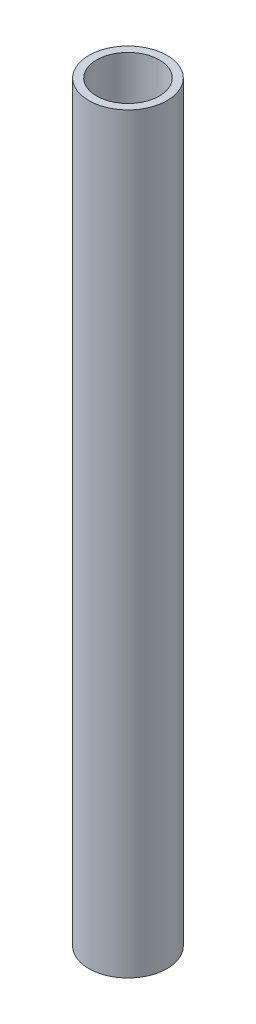
from build123d import *

# Parameters (mm, degrees)
TUBE_STOCK_EXTRUDE_DEPTH      = 152.4
TUBE_STOCK_EXTRUDE_DEPTH_BACK = 152.4
SKETCH2_R                     = 15.875
SKETCH2_R_2                   = 12.7


with BuildPart() as part:
    # Sketch2 → Tube Stock - Extrude (new, two sides: drawn at the far end of the back side and taken through both)
    with BuildSketch(Plane(origin=(0, 0, 0), x_dir=(1, 0, 0), z_dir=(0, 1, 0)).offset(-TUBE_STOCK_EXTRUDE_DEPTH_BACK)):
        with Locations(Location((0, 0, 0), (0, 0, 270))):
            Circle(SKETCH2_R)
        with Locations(Location((0, 0, 0), (0, 0, 270))):
            Circle(SKETCH2_R_2, mode=Mode.SUBTRACT)
    extrude(amount=TUBE_STOCK_EXTRUDE_DEPTH + TUBE_STOCK_EXTRUDE_DEPTH_BACK)


solid = part.part
